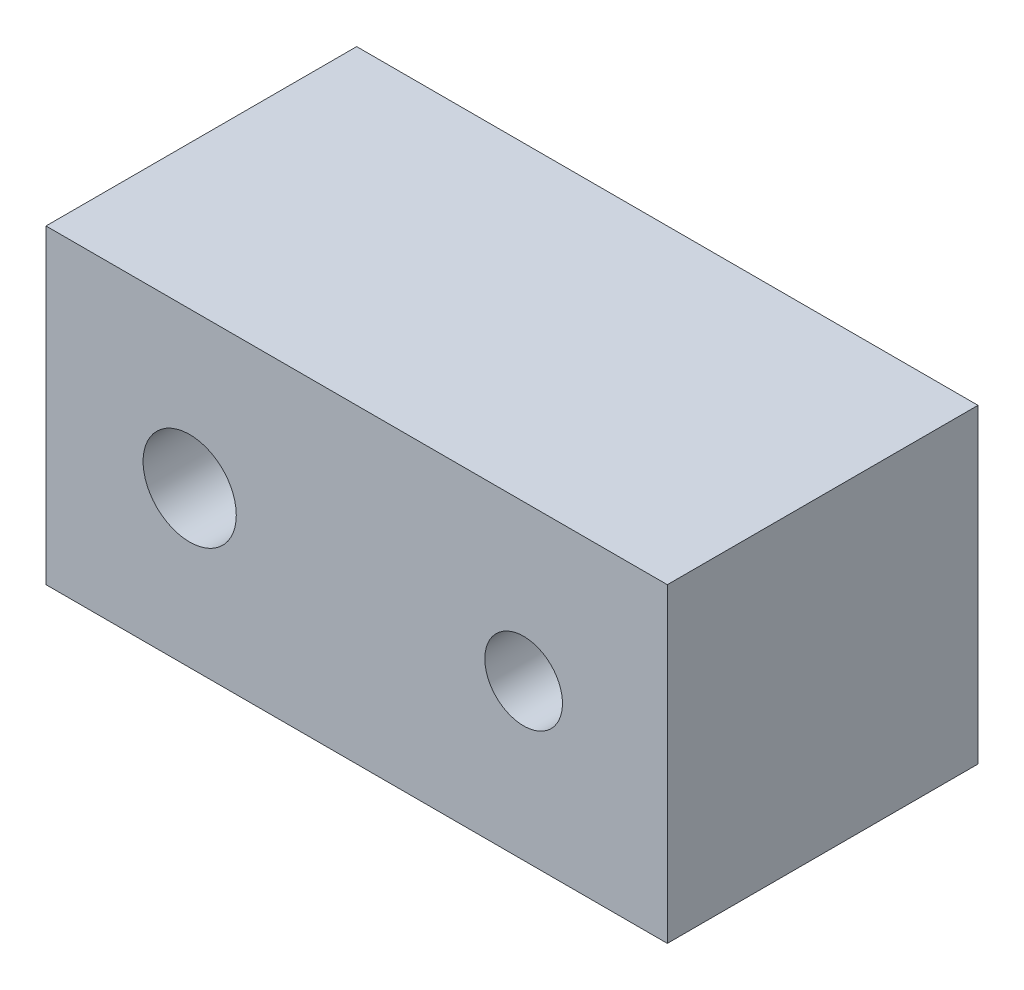
from build123d import *

# Parameters (mm, degrees)
SKETCH_1_W                   = 40
SKETCH_1_H                   = 20
EXTRUDE_1_DEPTH              = 20
HOLE_WIZARD_M6_1_D           = 5
HOLE_WIZARD_M6_1_CSINK_D     = 6.05
HOLE_WIZARD_M6_1_CSINK_ANGLE = 90
SKETCH_3_R                   = 3
CUT_EXTRUDE_1_DEPTH          = 31


with BuildPart() as part:
    # 草图1 → 凸台-拉伸1 (new body)
    with BuildSketch(Plane.XY):
        Rectangle(SKETCH_1_W, SKETCH_1_H)
    extrude(amount=EXTRUDE_1_DEPTH)

    # M6 螺纹孔1 (through all)
    with Locations(Plane(origin=(10.75, 0, 0), x_dir=(-1, 0, 0), z_dir=(0, 0, -1))):
        with Locations((0, 0)):
            CounterSinkHole(HOLE_WIZARD_M6_1_D / 2, HOLE_WIZARD_M6_1_CSINK_D / 2, counter_sink_angle=HOLE_WIZARD_M6_1_CSINK_ANGLE)

    # 草图3 → 切除-拉伸1 (cut, through all)
    with BuildSketch(Plane.XY.offset(20)):
        with Locations((-10.75, 0)):
            Circle(SKETCH_3_R)
    extrude(amount=-CUT_EXTRUDE_1_DEPTH, mode=Mode.SUBTRACT)


solid = part.part
